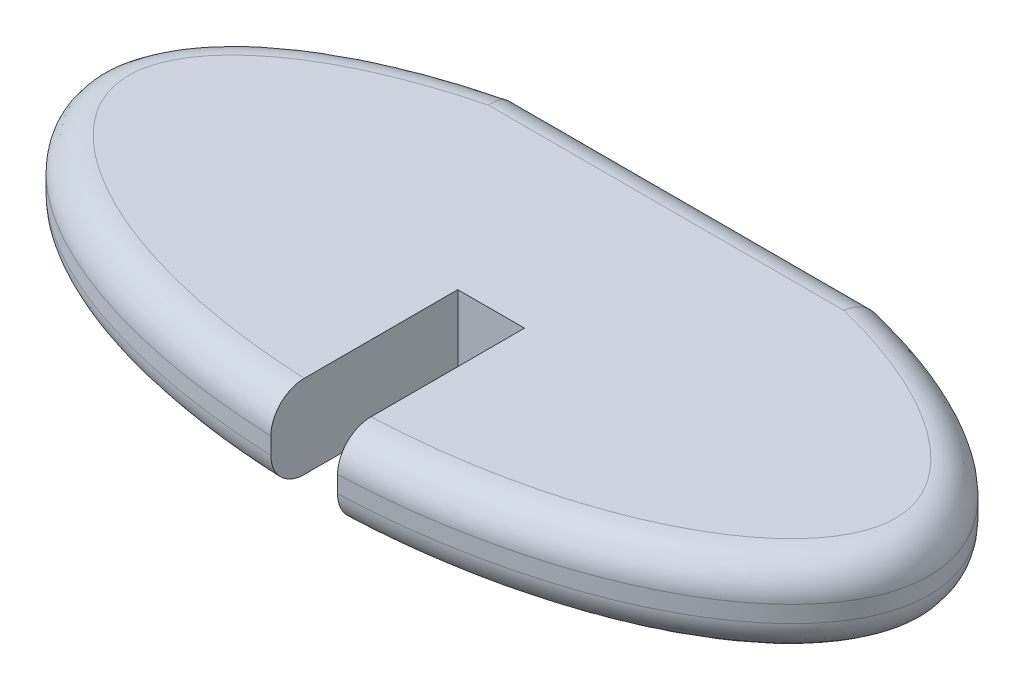
from build123d import *

# Parameters (mm, degrees)
BOSS_EXTRUDE1_DEPTH = 10
SKETCH5_W           = 8
SKETCH5_H           = 30
CUT_EXTRUDE4_DEPTH  = 10
FILLET12_R          = 4


with BuildPart() as part:
    # Sketch1 → Boss-Extrude1 (new body)
    with BuildSketch(Plane(origin=(0, 0, 0), x_dir=(1, 0, 0), z_dir=(0, 1, 0))):
        with BuildLine():
            Line((-21.794494718, 22.5), (21.794494718, 22.5))
            add(Edge.make_bspline(
                [(-21.794494718, 22.5), (-78.136825066, 8.856081987), (-39.068412533, -15.601755848), (0, -40.059593683), (39.068412533, -15.601755848), (78.136825066, 8.856081987), (21.794494718, 22.5)],
                knots=[2.021823139, 2.021823139, 2.021823139, 3.8155337, 3.8155337, 5.609244261, 5.609244261, 7.402954822, 7.402954822, 7.402954822], degree=2, weights=[1, 0.624070234, 1, 0.624070234, 1, 0.624070234, 1]))
        make_face()
    extrude(amount=BOSS_EXTRUDE1_DEPTH)

    # Sketch5 → Cut-Extrude4 (cut)
    with BuildSketch(Plane(origin=(0, 10, 0), x_dir=(1, 0, 0), z_dir=(0, 1, 0))):
        with Locations((0, -17.5)):
            Rectangle(SKETCH5_W, SKETCH5_H)
    extrude(amount=-CUT_EXTRUDE4_DEPTH, mode=Mode.SUBTRACT)

    # Fillet12
    fillet12_edges = [part.edges().sort_by_distance(p)[0] for p in [
        (47.117377831, 10, 8.365893651),
        (0, 0, -22.5),
        (-47.117377875, 0, 8.365893589),
        (-47.117377875, 10, 8.365893589),
        (0, 10, -22.5),
        (47.117377831, 0, 8.365893651),
    ]]
    fillet(fillet12_edges, radius=FILLET12_R)


solid = part.part
